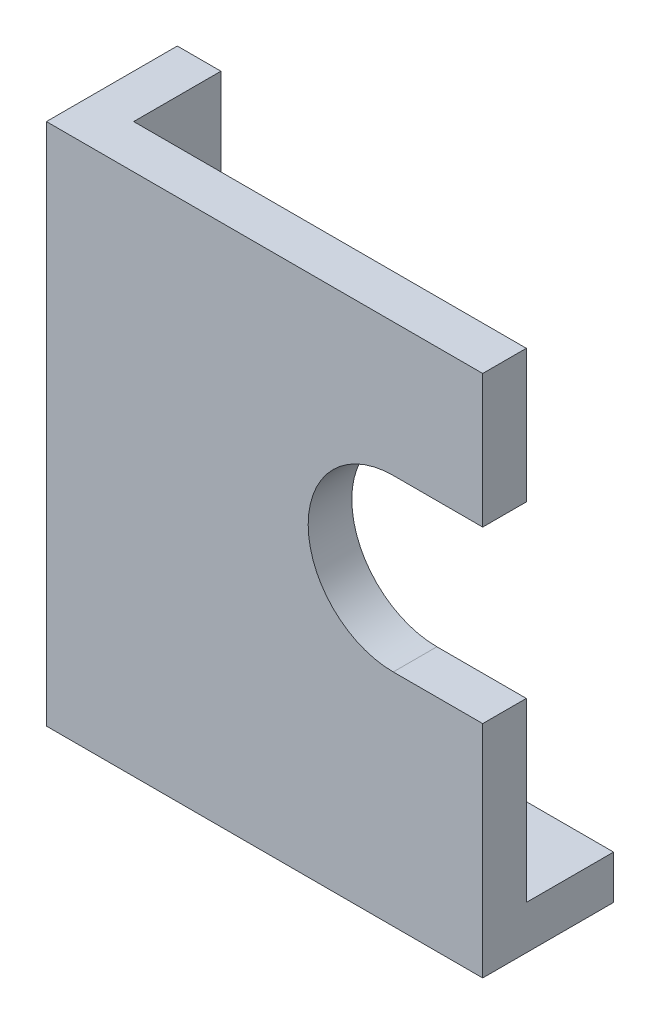
from build123d import *

# Parameters (mm, degrees)
BOSS_EXTRUDE1_DEPTH = 60
SKETCH4_W           = 10
SKETCH4_H           = 90
BOSS_EXTRUDE2_DEPTH = 45
SKETCH6_W           = 25
SKETCH6_H           = 10
BOSS_EXTRUDE3_DEPTH = 45
SKETCH8_W           = 10
SKETCH8_H           = 15
BOSS_EXTRUDE4_DEPTH = 90
CUT_EXTRUDE1_DEPTH  = 10
BOSS_EXTRUDE5_DEPTH = 20
CUT_EXTRUDE2_DEPTH  = 5
SKETCH12_W          = 10
SKETCH12_H          = 30.5
CUT_EXTRUDE3_DEPTH  = 5
BOSS_EXTRUDE6_DEPTH = 5


with BuildPart() as part:
    # Sketch1 → Boss-Extrude1 (new body)
    with BuildSketch(Plane(origin=(0, 0, 0), x_dir=(0, 0, -1), z_dir=(1, 0, 0))):
        Polygon((0, -10), (0, 90), (10, 90), (10, 0), (25, 0), (25, -10), align=None)
    extrude(amount=BOSS_EXTRUDE1_DEPTH)

    # Sketch4 → Boss-Extrude2 (add)
    with BuildSketch(Plane.ZY):
        with Locations((-5, 45)):
            Rectangle(SKETCH4_W, SKETCH4_H)
    extrude(amount=BOSS_EXTRUDE2_DEPTH)

    # Sketch6 → Boss-Extrude3 (add)
    with BuildSketch(Plane.ZY):
        with Locations((-12.5, -5)):
            Rectangle(SKETCH6_W, SKETCH6_H)
    extrude(amount=BOSS_EXTRUDE3_DEPTH)

    # Sketch8 → Boss-Extrude4 (add)
    with BuildSketch(Plane(origin=(0, 0, 0), x_dir=(1, 0, 0), z_dir=(0, 1, 0))):
        with Locations((-40, 17.5)):
            Rectangle(SKETCH8_W, SKETCH8_H)
    extrude(amount=BOSS_EXTRUDE4_DEPTH)

    # Sketch9 → Cut-Extrude1 (cut)
    with BuildSketch(Plane(origin=(0, 0, -10), x_dir=(-1, 0, 0), z_dir=(0, 0, -1))):
        with BuildLine():
            Line((-34.5, 40.5), (-60, 40.5))
            Line((-60, 40.5), (-60, 79.5))
            Line((-60, 79.5), (-34.5, 79.5))
            ThreePointArc((-34.5, 79.5), (-15, 60), (-34.5, 40.5))
        make_face()
    extrude(amount=-CUT_EXTRUDE1_DEPTH, mode=Mode.SUBTRACT)

    # Sketch10 → Boss-Extrude5 (add)
    with BuildSketch(Plane(origin=(0, 90, 0), x_dir=(1, 0, 0), z_dir=(0, 1, 0))):
        Polygon((60, 10), (-35, 10), (-35, 25), (-45, 25), (-45, 0), (60, 0), align=None)
    extrude(amount=BOSS_EXTRUDE5_DEPTH)

    # Sketch11 → Cut-Extrude2 (cut)
    with BuildSketch(Plane(origin=(60, 0, 0), x_dir=(0, 0, -1), z_dir=(1, 0, 0))):
        Polygon((10, 0), (10, 40.5), (0, 40.5), (0, -10), (25, -10), (25, 0), align=None)
    extrude(amount=-CUT_EXTRUDE2_DEPTH, mode=Mode.SUBTRACT)

    # Sketch12 → Cut-Extrude3 (cut)
    with BuildSketch(Plane(origin=(60, 0, 0), x_dir=(0, 0, -1), z_dir=(1, 0, 0))):
        with Locations((5, 94.75)):
            Rectangle(SKETCH12_W, SKETCH12_H)
    extrude(amount=-CUT_EXTRUDE3_DEPTH, mode=Mode.SUBTRACT)

    # Sketch13 → Boss-Extrude6 (add)
    with BuildSketch(Plane(origin=(0, 0, -25), x_dir=(-1, 0, 0), z_dir=(0, 0, -1))):
        Polygon((35, 0), (-55, 0), (-55, -10), (45, -10), (45, 110), (35, 110), align=None)
    extrude(amount=BOSS_EXTRUDE6_DEPTH)


solid = part.part
